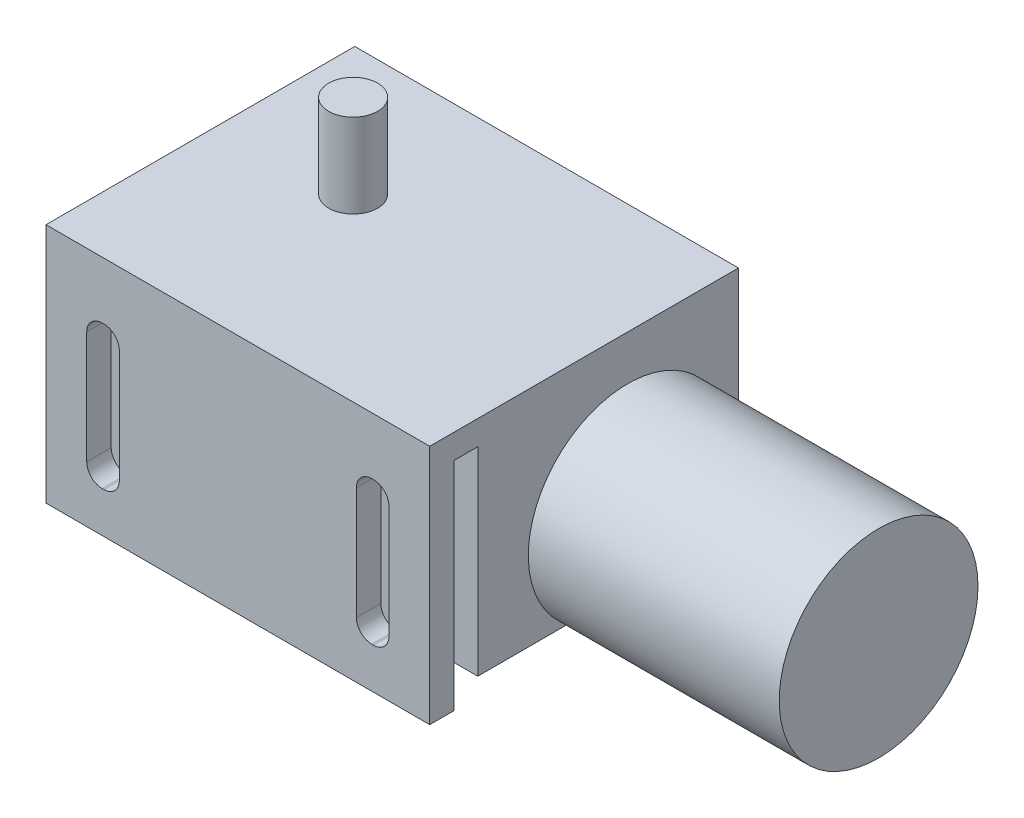
from build123d import *

# Parameters (mm, degrees)
SKETCH_4_W            = 47.1
SKETCH_4_H            = 29.6
EXTRUDE_256_DEPTH     = 37.9
SKETCH_8_W            = 47.1
SKETCH_8_H            = 32
CUT_EXTRUDE_1_DEPTH   = 2.2
SKETCH_12_W           = 47.1
SKETCH_12_H           = 2.9
CUT_EXTRUDE_619_DEPTH = 26.6
CUT_EXTRUDE_3_DEPTH   = 3
SKETCH_17_R           = 3
EXTRUDE_1677_DEPTH    = 10.3
SKETCH_19_R           = 12.2
EXTRUDE_1895_DEPTH    = 30.8


with BuildPart() as part:
    # 草图4 → Extrude 256 (new body)
    with BuildSketch(Plane.XY):
        Rectangle(SKETCH_4_W, SKETCH_4_H)
    extrude(amount=EXTRUDE_256_DEPTH)

    # 草图8 → 切除-拉伸1 (cut)
    with BuildSketch(Plane.XZ.offset(14.8)):
        with Locations((0, 16)):
            Rectangle(SKETCH_8_W, SKETCH_8_H)
    extrude(amount=-CUT_EXTRUDE_1_DEPTH, mode=Mode.SUBTRACT)

    # 草图12 → Cut-Extrude 619 (cut)
    with BuildSketch(Plane.XZ.offset(14.8)):
        with Locations((0, 33.45)):
            Rectangle(SKETCH_12_W, SKETCH_12_H)
    extrude(amount=-CUT_EXTRUDE_619_DEPTH, mode=Mode.SUBTRACT)

    # 草图14 → 切除-拉伸3 (cut)
    with BuildSketch(Plane.XY.offset(37.9)):
        with BuildLine():
            ThreePointArc((-14.55, 5.9), (-15.106497116, 7.243502884), (-16.45, 7.8))
            Line((-16.45, 7.8), (-16.65, 7.8))
            ThreePointArc((-16.65, 7.8), (-17.993502884, 7.243502884), (-18.55, 5.9))
            Line((-18.55, 5.9), (-18.55, -7.9))
            ThreePointArc((-18.55, -7.9), (-17.993502884, -9.243502884), (-16.65, -9.8))
            Line((-16.65, -9.8), (-16.45, -9.8))
            ThreePointArc((-16.45, -9.8), (-15.106497116, -9.243502884), (-14.55, -7.9))
            Line((-14.55, -7.9), (-14.55, 5.9))
        make_face()
    cut_extrude_3 = extrude(amount=-CUT_EXTRUDE_3_DEPTH, mode=Mode.SUBTRACT)

    # 镜向3: 切除-拉伸3 across plane
    add(cut_extrude_3.mirror(Plane(origin=(0, 0, 0), x_dir=(0, 0, 1), z_dir=(1, 0, 0))), mode=Mode.SUBTRACT)

    # 草图17 → Extrude 1677 (add)
    with BuildSketch(Plane(origin=(0, 14.8, 0), x_dir=(1, 0, 0), z_dir=(0, 1, 0))):
        with Locations(Location((-7.95, -15.8, 0), (0, 0, 90))):
            Circle(SKETCH_17_R)
    extrude(amount=EXTRUDE_1677_DEPTH)

    # 草图19 → Extrude 1895 (add)
    with BuildSketch(Plane(origin=(23.55, 0, 0), x_dir=(0, 0, -1), z_dir=(1, 0, 0))):
        with Locations(Location((-13.6, -2.9, 0), (0, 0, 232.66299834))):
            Circle(SKETCH_19_R)
    extrude(amount=EXTRUDE_1895_DEPTH)


solid = part.part
